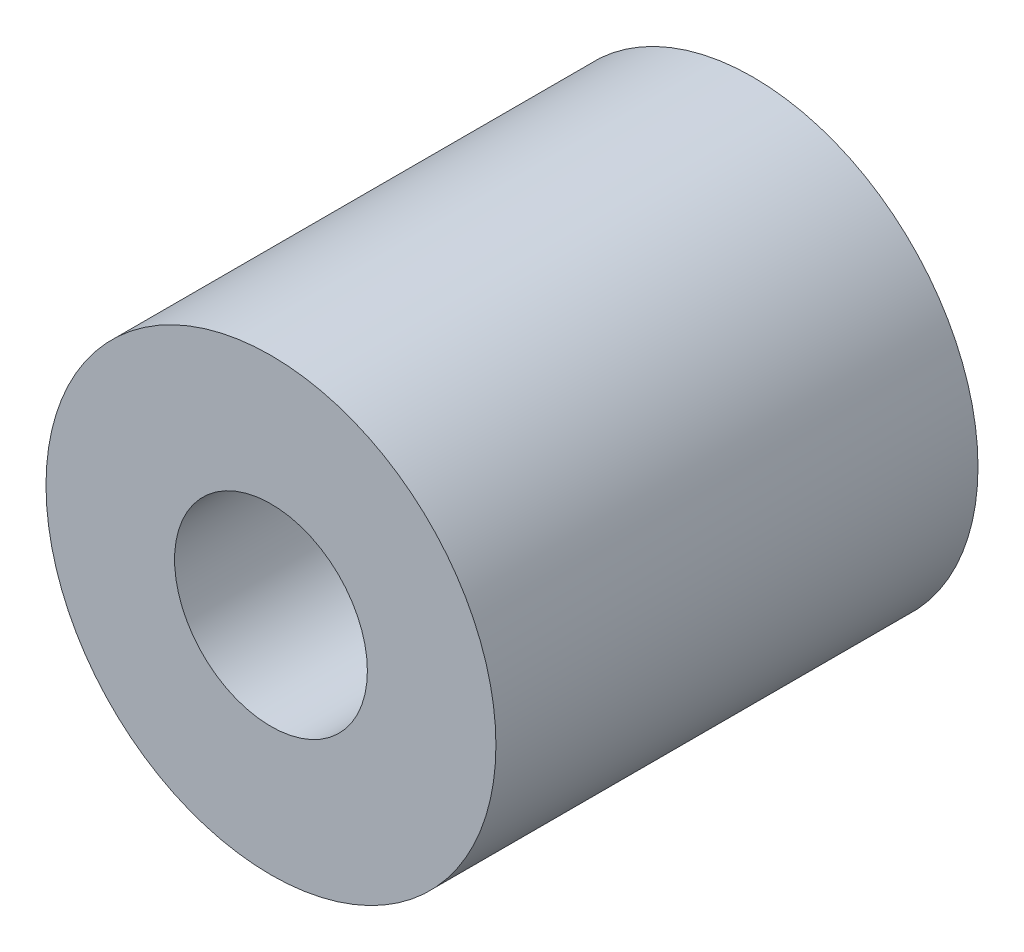
from build123d import *

# Parameters (mm, degrees)
SKETCH_1_R      = 7
SKETCH_1_R_2    = 3
EXTRUDE_1_DEPTH = 15


with BuildPart() as part:
    # Эскиз1 → Вытянуть1 (new body)
    with BuildSketch(Plane.XY):
        Circle(SKETCH_1_R)
        Circle(SKETCH_1_R_2, mode=Mode.SUBTRACT)
    extrude(amount=EXTRUDE_1_DEPTH)


solid = part.part
